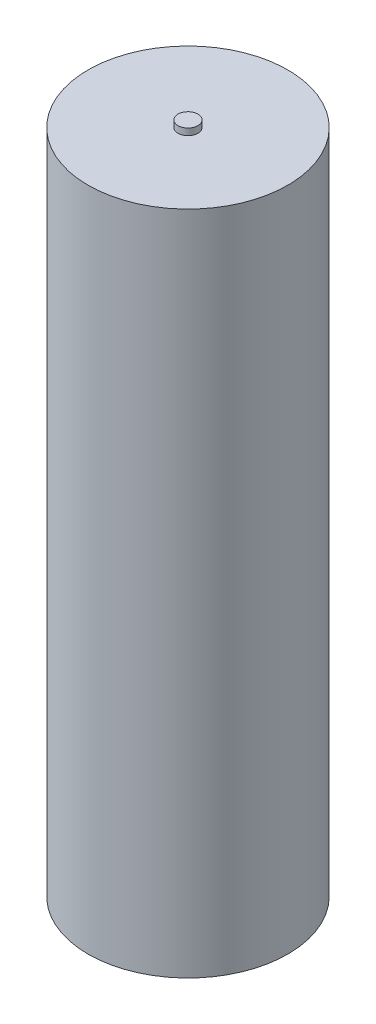
from build123d import *

# Parameters (mm, degrees)
SKETCH1_R           = 1500
BOSS_EXTRUDE1_DEPTH = 10000
SKETCH2_R           = 150
BOSS_EXTRUDE2_DEPTH = 100


with BuildPart() as part:
    # Sketch1 → Boss-Extrude1 (new body)
    with BuildSketch(Plane(origin=(0, 0, 0), x_dir=(1, 0, 0), z_dir=(0, 1, 0))):
        with Locations(Location((0, 0, 0), (0, 0, 270))):
            Circle(SKETCH1_R)
    extrude(amount=BOSS_EXTRUDE1_DEPTH)

    # Sketch2 → Boss-Extrude2 (add)
    with BuildSketch(Plane(origin=(0, 10000, 0), x_dir=(1, 0, 0), z_dir=(0, 1, 0))):
        with Locations(Location((0, 0, 0), (0, 0, 270))):
            Circle(SKETCH2_R)
    extrude(amount=BOSS_EXTRUDE2_DEPTH)


solid = part.part
